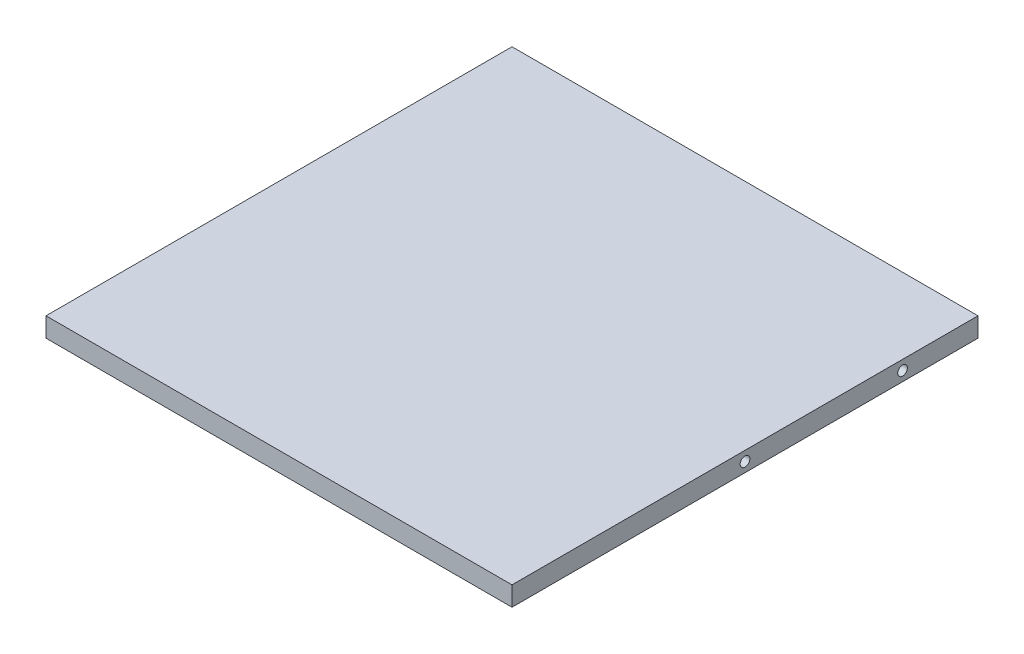
from build123d import *

# Parameters (mm, degrees)
SKETCH2_W           = 304.8
SKETCH2_H           = 304.8
BOSS_EXTRUDE1_DEPTH = 12.7
SKETCH3_R           = 3.175
CUT_EXTRUDE1_DEPTH  = 343.16151121
SKETCH4_R           = 3.175
CUT_EXTRUDE2_DEPTH  = 343.16151121


with BuildPart() as part:
    # Sketch2 → Boss-Extrude1 (new body)
    with BuildSketch(Plane(origin=(0, 0, 0), x_dir=(1, 0, 0), z_dir=(0, 1, 0))):
        with Locations((-98.440191388, 2.55215311)):
            Rectangle(SKETCH2_W, SKETCH2_H)
    extrude(amount=BOSS_EXTRUDE1_DEPTH)

    # Sketch3 → Cut-Extrude1 (cut, through all)
    with BuildSketch(Plane(origin=(53.959808612, 0, 0), x_dir=(0, 0, -1), z_dir=(1, 0, 0))):
        with Locations((2.55215311, 6.35)):
            Circle(SKETCH3_R)
    extrude(amount=-CUT_EXTRUDE1_DEPTH, mode=Mode.SUBTRACT)

    # Sketch4 → Cut-Extrude2 (cut, through all)
    with BuildSketch(Plane.ZY.offset(250.840191388)):
        with Locations((-105.600481839, 6.35)):
            Circle(SKETCH4_R)
    extrude(amount=-CUT_EXTRUDE2_DEPTH, mode=Mode.SUBTRACT)


solid = part.part
